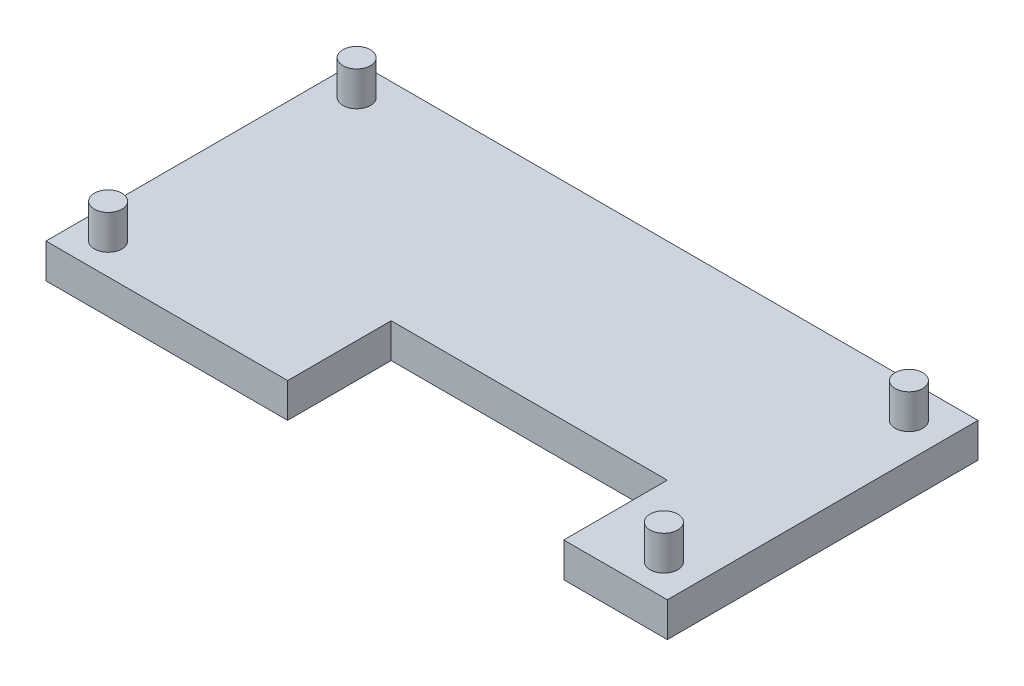
from build123d import *

# Parameters (mm, degrees)
BOSS_EXTRUDE9_DEPTH  = 5
SKETCH6_3_R          = 2
BOSS_EXTRUDE10_DEPTH = 10


with BuildPart() as part:
    # Sketch6 → Boss-Extrude9 (new body)
    with BuildSketch(Plane(origin=(0, 0, 0), x_dir=(1, 0, 0), z_dir=(0, 1, 0))):
        Polygon((98.912801806, 26.664335605), (8.912801806, 26.664335605), (8.912801806, -18.335664395), (43.912801806, -18.335664395), (43.912801806, -3.335664395), (83.912801806, -3.335664395), (83.912801806, -18.335664395), (98.912801806, -18.335664395), align=None)
    extrude(amount=BOSS_EXTRUDE9_DEPTH)

    # Sketch6<3> → Boss-Extrude10 (add)
    with BuildSketch(Plane(origin=(0, 0, 0), x_dir=(1, 0, 0), z_dir=(0, 1, 0))):
        with Locations((13.412801806, 22.164335605)):
            Circle(SKETCH6_3_R)
        with Locations((13.412801806, -13.835664395)):
            Circle(SKETCH6_3_R)
        with Locations((93.912801806, -13.835664395)):
            Circle(SKETCH6_3_R)
        with Locations((93.912801806, 21.664335605)):
            Circle(SKETCH6_3_R)
    extrude(amount=BOSS_EXTRUDE10_DEPTH)


solid = part.part
